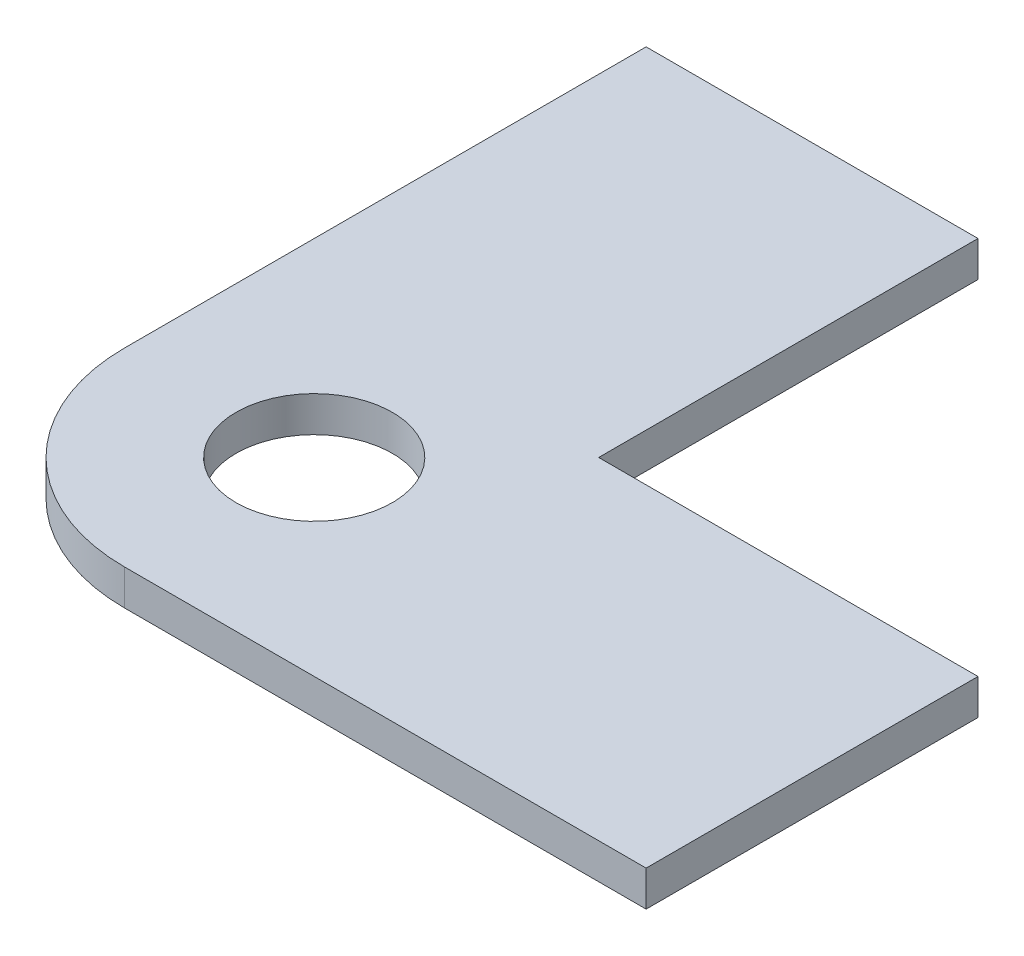
from build123d import *

# Parameters (mm, degrees)
SKETCH1_R           = 1.65
BOSS_EXTRUDE1_DEPTH = 0.75


with BuildPart() as part:
    # Sketch1 → Boss-Extrude1 (new body)
    with BuildSketch(Plane(origin=(0, 0, 0), x_dir=(1, 0, 0), z_dir=(0, 1, 0))):
        with BuildLine():
            Line((11, -3.99967418), (11, 3))
            Line((11, 3), (3, 3))
            Line((3, 3), (3, 11))
            Line((3, 11), (-3.99967418, 11))
            Line((-3.99967418, 11), (-3.99967418, 0))
            ThreePointArc((-3.99967418, 0), (-2.828196736, -2.828196736), (0, -3.99967418))
            Line((0, -3.99967418), (11, -3.99967418))
        make_face()
        with Locations(Location((0, 0, 0), (0, 0, 270))):
            Circle(SKETCH1_R, mode=Mode.SUBTRACT)
    extrude(amount=BOSS_EXTRUDE1_DEPTH)


solid = part.part
